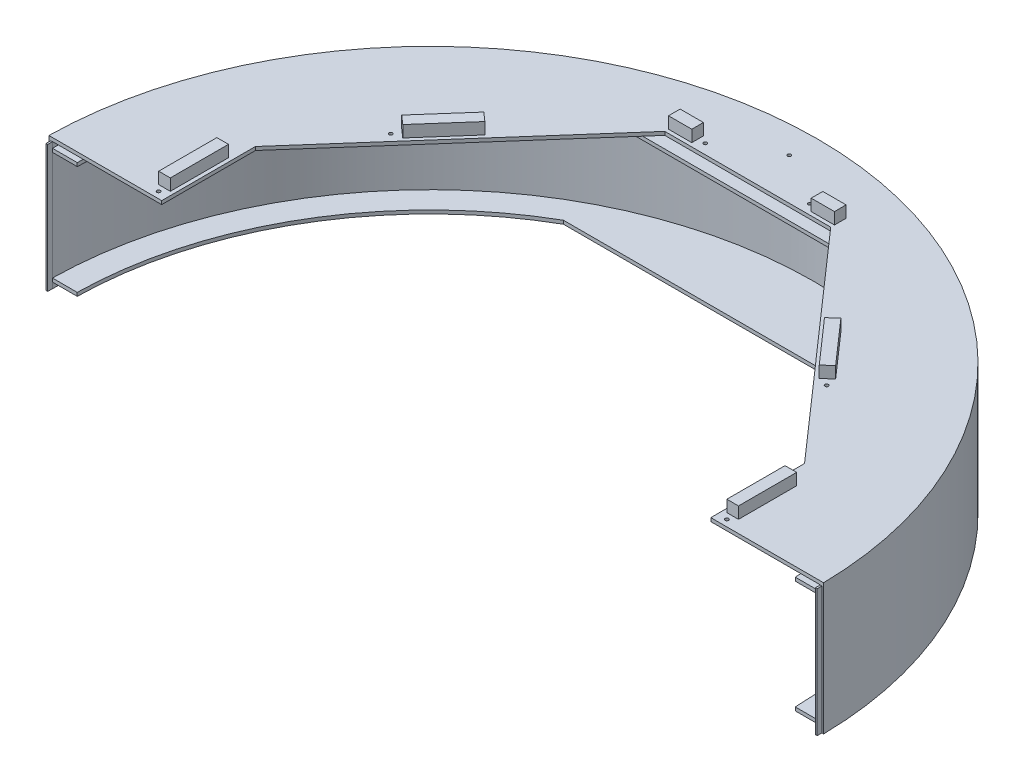
from build123d import *

# Parameters (mm, degrees)
BOSS_EXTRUDE2_DEPTH      = 3
BOSS_EXTRUDE2_DEPTH_BACK = 109.6
SKETCH3_R                = 333
SKETCH3_R_2              = 330
SKETCH5_R                = 330
BOSS_EXTRUDE4_DEPTH      = 3
SKETCH6_R                = 333
BOSS_EXTRUDE6_DEPTH      = 3
SKETCH17_R               = 330
BOSS_EXTRUDE9_DEPTH      = 3
CUT_EXTRUDE1_DEPTH       = 503.240857237
CUT_EXTRUDE1_DEPTH_BACK  = 503.240857237
SKETCH18_W               = 721.551246538
SKETCH18_H               = 348.822819085
SKETCH19_W               = 10
SKETCH19_H               = 50
SKETCH19_W_2             = 20
SKETCH19_H_2             = 10
BOSS_EXTRUDE10_DEPTH     = 10
SKETCH23_W               = 1.500186503
SKETCH23_H               = 109.4
BOSS_EXTRUDE11_DEPTH     = 4
CUT_EXTRUDE2_START       = -11
SKETCH25_R               = 1.5
CUT_EXTRUDE2_DEPTH       = 11


with BuildPart() as part:
    # Sketch3 → Boss-Extrude2 (new, two sides: drawn at the far end of the back side and taken through both)
    with BuildSketch(Plane(origin=(0, 0, 0), x_dir=(1, 0, 0), z_dir=(0, 1, 0)).offset(-BOSS_EXTRUDE2_DEPTH_BACK)):
        with Locations(Location((-11.008302555, 15.174390861, 0), (0, 0, 270))):
            Circle(SKETCH3_R)
        with Locations(Location((-11.008302555, 15.174390861, 0), (0, 0, 270))):
            Circle(SKETCH3_R_2, mode=Mode.SUBTRACT)
    extrude(amount=BOSS_EXTRUDE2_DEPTH + BOSS_EXTRUDE2_DEPTH_BACK)

    # Sketch5 → Boss-Extrude4 (add)
    with BuildSketch(Plane.XZ.offset(104.6)):
        with Locations(Location((-11.008302555, -15.174390861, 0), (0, 0, 90))):
            Circle(SKETCH5_R)
        with BuildLine():
            Line((-164.332788108, -283.060090014), (142.316182998, -283.060090014))
            ThreePointArc((142.316182998, -283.060090014), (-11.008302555, 293.485852256), (-164.332788108, -283.060090014))
        make_face(mode=Mode.SUBTRACT)
    extrude(amount=-BOSS_EXTRUDE4_DEPTH)

    # Sketch6 → Boss-Extrude6 (add)
    with BuildSketch(Plane(origin=(0, 0, 0), x_dir=(1, 0, 0), z_dir=(0, 1, 0))):
        with Locations(Location((-11.008302555, 15.174390861, 0), (0, 0, 270))):
            Circle(SKETCH6_R)
        Polygon((187.991697445, -189.598621739), (187.991697445, 20.401378261), (224.991697445, 20.401378261), (224.991697445, 100.970480915), (60.317326344, 288.174390861), (-82.333931455, 288.174390861), (-247.008302555, 100.970480915), (-247.008302555, 20.401378261), (-210.008302555, 20.401378261), (-210.008302555, -189.598621739), align=None, mode=Mode.SUBTRACT)
    extrude(amount=BOSS_EXTRUDE6_DEPTH)

    # Sketch17 → Boss-Extrude9 (add)
    with BuildSketch(Plane(origin=(0, -5, 0), x_dir=(1, 0, 0), z_dir=(0, 1, 0))):
        with Locations(Location((-11.008302555, 15.174390861, 0), (0, 0, 270))):
            Circle(SKETCH17_R)
        with BuildLine():
            Line((142.316182998, 283.060090014), (-164.332788108, 283.060090014))
            ThreePointArc((-164.332788108, 283.060090014), (-11.008302555, -293.485852256), (142.316182998, 283.060090014))
        make_face(mode=Mode.SUBTRACT)
    extrude(amount=-BOSS_EXTRUDE9_DEPTH)

    # Sketch18 → Cut-Extrude1 (cut, two sides: drawn at the far end of the back side and taken through both)
    with BuildSketch(Plane(origin=(0, 3, 0), x_dir=(1, 0, 0), z_dir=(0, 1, 0)).offset(-CUT_EXTRUDE1_DEPTH_BACK)):
        with Locations((-2.663832357, -154.010031282)):
            Rectangle(SKETCH18_W, SKETCH18_H)
    extrude(amount=CUT_EXTRUDE1_DEPTH + CUT_EXTRUDE1_DEPTH_BACK, mode=Mode.SUBTRACT)

    # Sketch19 → Boss-Extrude10 (add)
    with BuildSketch(Plane(origin=(0, 3, 0), x_dir=(1, 0, 0), z_dir=(0, 1, 0))):
        Polygon((-190.005313879, 170.617155509), (-156.981273896, 208.159302266), (-164.489703247, 214.764110263), (-197.513743231, 177.221963505), align=None)
        Polygon((167.988708769, 170.617155509), (134.964668786, 208.159302266), (142.473098137, 214.764110263), (175.49713812, 177.221963505), align=None)
        with Locations((-255.208302555, 56.010036487)):
            Rectangle(SKETCH19_W, SKETCH19_H)
        with Locations((233.191697445, 56.010036487)):
            Rectangle(SKETCH19_W, SKETCH19_H)
        with Locations((-72.333931455, 296.374390861)):
            Rectangle(SKETCH19_W_2, SKETCH19_H_2)
        with Locations((50.317326344, 296.374390861)):
            Rectangle(SKETCH19_W_2, SKETCH19_H_2)
    extrude(amount=BOSS_EXTRUDE10_DEPTH)

    # Sketch23 → Boss-Extrude11 (add)
    with BuildSketch(Plane.XY.offset(-20.401378261)):
        with Locations((319.700392044, -54.9)):
            Rectangle(SKETCH23_W, SKETCH23_H)
        with Locations((-341.716997154, -54.9)):
            Rectangle(SKETCH23_W, SKETCH23_H)
    extrude(amount=BOSS_EXTRUDE11_DEPTH)

    # Sketch25 → Cut-Extrude2 (cut)
    with BuildSketch(Plane(origin=(0, 3, 0), x_dir=(1, 0, 0), z_dir=(0, 1, 0)).offset(CUT_EXTRUDE2_START)):
        with Locations(Location((-56.008302555, 296.667912331, 0), (0, 0, 270))):
            Circle(SKETCH25_R)
        with Locations(Location((33.991697445, 296.667912331, 0), (0, 0, 270))):
            Circle(SKETCH25_R)
        with Locations(Location((-11.008302555, 323.834633978, 0), (0, 0, 270))):
            Circle(SKETCH25_R)
        with Locations(Location((-198.376364015, 168.671082504, 0), (0, 0, 270))):
            Circle(SKETCH25_R)
        with Locations(Location((176.359758905, 168.671082504, 0), (0, 0, 270))):
            Circle(SKETCH25_R)
        with Locations(Location((-255.208302555, 25.978544832, 0), (0, 0, 270))):
            Circle(SKETCH25_R)
        with Locations(Location((233.191697445, 25.978544832, 0), (0, 0, 270))):
            Circle(SKETCH25_R)
    extrude(amount=CUT_EXTRUDE2_DEPTH, mode=Mode.SUBTRACT)


solid = part.part
